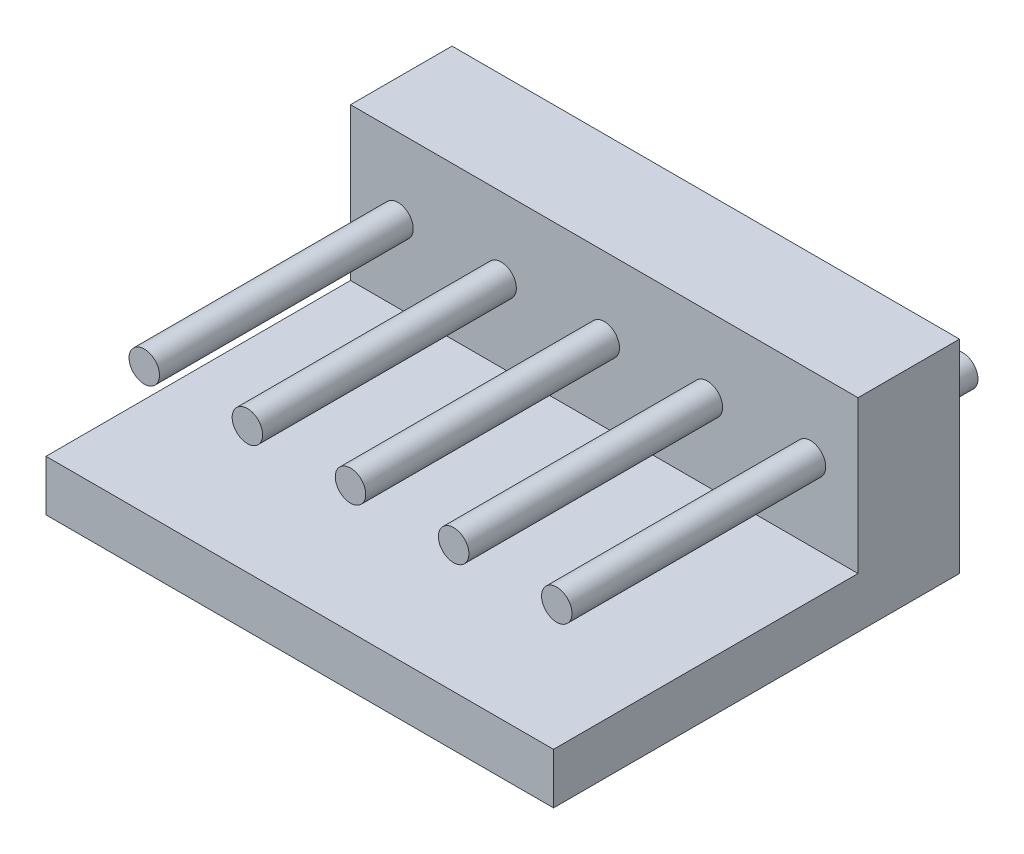
from build123d import *

# Parameters (mm, degrees)
SKETCH_1_W           = 25
SKETCH_1_H           = 10
EXTRUDE_1_DEPTH      = 5
SKETCH_2_W           = 25
SKETCH_2_H           = 2.5
EXTRUDE_2_DEPTH      = 15
EXTRUDE_3_DEPTH      = 12.5
EXTRUDE_3_DEPTH_BACK = 7.5
SKETCH_3_R           = 0.75


with BuildPart() as part:
    # Эскиз1 → Вытянуть1 (new body)
    with BuildSketch(Plane.XY):
        with Locations((12.5, 5)):
            Rectangle(SKETCH_1_W, SKETCH_1_H)
    extrude(amount=EXTRUDE_1_DEPTH)

    # Эскиз2 → Вытянуть2 (add)
    with BuildSketch(Plane.XY.offset(5)):
        with Locations((12.5, 1.25)):
            Rectangle(SKETCH_2_W, SKETCH_2_H)
    extrude(amount=EXTRUDE_2_DEPTH)

    # Эскиз3 → Вытянуть3 (add, two sides: drawn at the far end of the back side and taken through both)
    with BuildSketch(Plane.XY.offset(5).offset(-EXTRUDE_3_DEPTH_BACK)):
        with Locations((17.58, 6.25)):
            Circle(SKETCH_3_R)
        with Locations((22.66, 6.25)):
            Circle(SKETCH_3_R)
        with Locations((2.34, 6.25)):
            Circle(SKETCH_3_R)
        with Locations((7.42, 6.25)):
            Circle(SKETCH_3_R)
        with Locations((12.5, 6.25)):
            Circle(SKETCH_3_R)
    extrude(amount=EXTRUDE_3_DEPTH + EXTRUDE_3_DEPTH_BACK)


solid = part.part
